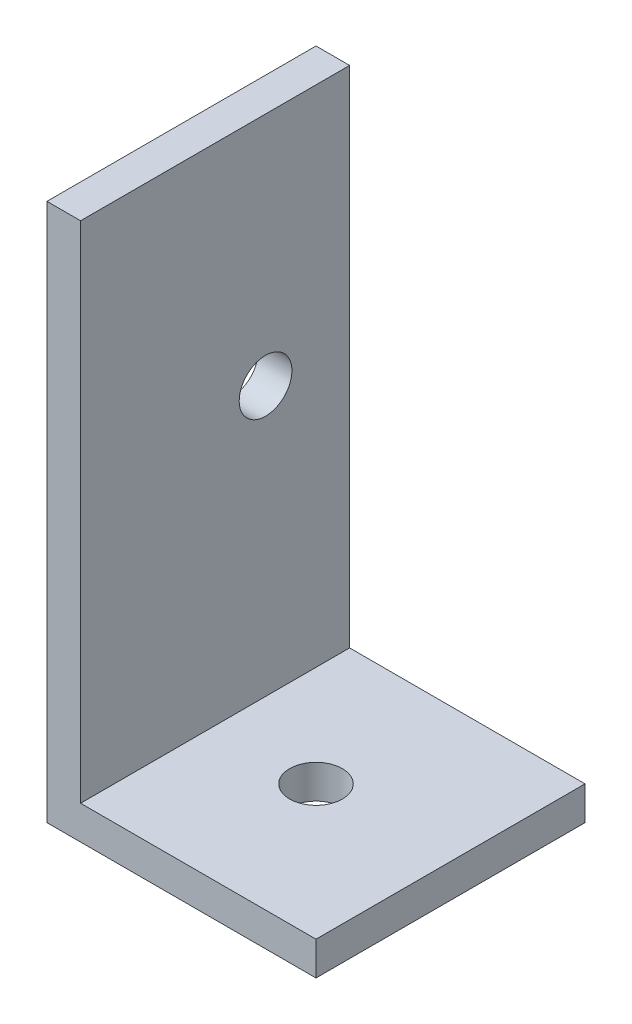
from build123d import *

# Parameters (mm, degrees)
BOSS_EXTRUDE1_DEPTH = 12.7
SKETCH2_R           = 2.4892
CUT_EXTRUDE1_DEPTH  = 56.448991199
SKETCH3_R           = 2.4892
CUT_EXTRUDE2_DEPTH  = 57.884801353


with BuildPart() as part:
    # Sketch1 → Boss-Extrude1 (new, symmetric)
    with BuildSketch(Plane.XY):
        Polygon((0, 0), (0, 50.8), (3.175, 50.8), (3.175, 3.175), (25.4, 3.175), (25.4, 0), align=None)
    extrude(amount=BOSS_EXTRUDE1_DEPTH, both=True)

    # Sketch2 → Cut-Extrude1 (cut, through all)
    with BuildSketch(Plane(origin=(0, 3.175, 0), x_dir=(1, 0, 0), z_dir=(0, 1, 0))):
        with Locations(Location((12.7, 0, 0), (0, 0, 180))):
            Circle(SKETCH2_R)
    extrude(amount=-CUT_EXTRUDE1_DEPTH, mode=Mode.SUBTRACT)

    # Sketch3 → Cut-Extrude2 (cut, through all)
    with BuildSketch(Plane(origin=(3.175, 0, 0), x_dir=(0, 0, -1), z_dir=(1, 0, 0))):
        with Locations(Location((4.7625, 28.575, 0), (0, 0, 90))):
            Circle(SKETCH3_R)
    extrude(amount=-CUT_EXTRUDE2_DEPTH, mode=Mode.SUBTRACT)


solid = part.part
